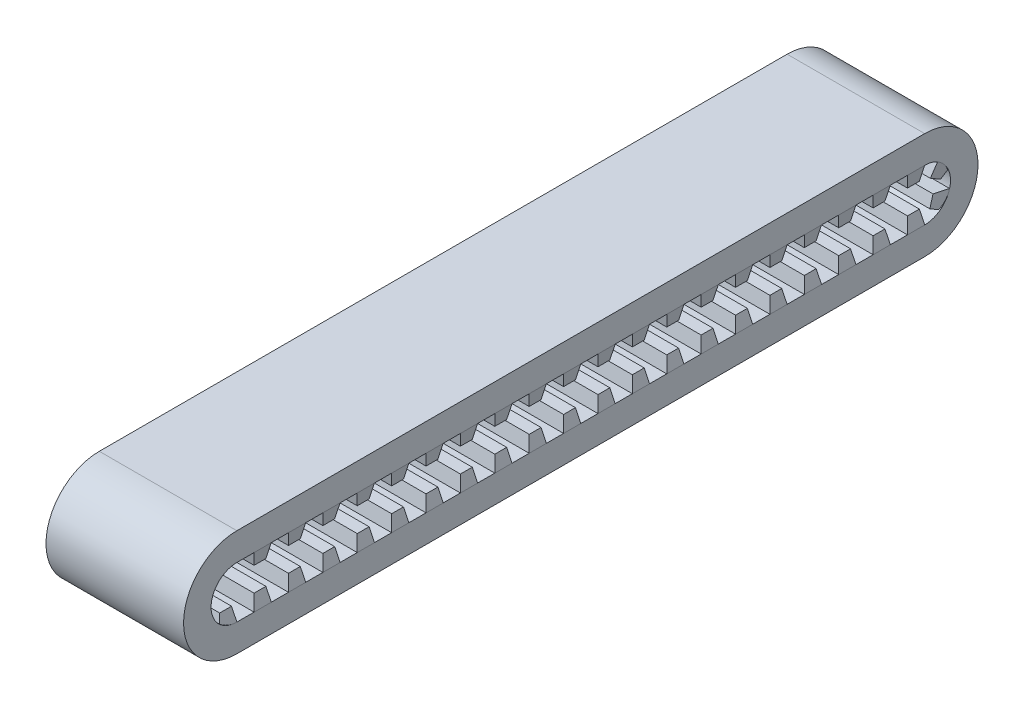
from build123d import *

# Parameters (mm, degrees)
BOSS_EXTRUDE1_DEPTH      = 40
SKETCH2_W                = 40
SKETCH2_H                = 5
BOSS_EXTRUDE2_DEPTH      = 4
BOSS_EXTRUDE2_TAPER      = 11
LPATTERN1_COUNT          = 19
LPATTERN1_PITCH          = 10
CIRPATTERN1_COUNT        = 3
CIRPATTERN1_ANGLE        = 150
MIRROR1_COPY_1_SKETCH_W  = 40
MIRROR1_COPY_1_SKETCH_H  = 5
MIRROR1_COPY_1_DEPTH     = 4
MIRROR1_COPY_1_TAPER     = 11
MIRROR1_COPY_2_SKETCH_W  = 40
MIRROR1_COPY_2_SKETCH_H  = 5
MIRROR1_COPY_2_DEPTH     = 4
MIRROR1_COPY_2_TAPER     = 11
MIRROR1_COPY_3_SKETCH_W  = 40
MIRROR1_COPY_3_SKETCH_H  = 5
MIRROR1_COPY_3_DEPTH     = 4
MIRROR1_COPY_3_TAPER     = 11
MIRROR1_COPY_4_SKETCH_W  = 40
MIRROR1_COPY_4_SKETCH_H  = 5
MIRROR1_COPY_4_DEPTH     = 4
MIRROR1_COPY_4_TAPER     = 11
MIRROR1_COPY_5_SKETCH_W  = 40
MIRROR1_COPY_5_SKETCH_H  = 5
MIRROR1_COPY_5_DEPTH     = 4
MIRROR1_COPY_5_TAPER     = 11
MIRROR1_COPY_6_SKETCH_W  = 40
MIRROR1_COPY_6_SKETCH_H  = 5
MIRROR1_COPY_6_DEPTH     = 4
MIRROR1_COPY_6_TAPER     = 11
MIRROR1_COPY_7_SKETCH_W  = 40
MIRROR1_COPY_7_SKETCH_H  = 5
MIRROR1_COPY_7_DEPTH     = 4
MIRROR1_COPY_7_TAPER     = 11
MIRROR1_COPY_8_SKETCH_W  = 40
MIRROR1_COPY_8_SKETCH_H  = 5
MIRROR1_COPY_8_DEPTH     = 4
MIRROR1_COPY_8_TAPER     = 11
MIRROR1_COPY_9_SKETCH_W  = 40
MIRROR1_COPY_9_SKETCH_H  = 5
MIRROR1_COPY_9_DEPTH     = 4
MIRROR1_COPY_9_TAPER     = 11
MIRROR1_COPY_10_SKETCH_W = 40
MIRROR1_COPY_10_SKETCH_H = 5
MIRROR1_COPY_10_DEPTH    = 4
MIRROR1_COPY_10_TAPER    = 11
MIRROR1_COPY_11_SKETCH_W = 40
MIRROR1_COPY_11_SKETCH_H = 5
MIRROR1_COPY_11_DEPTH    = 4
MIRROR1_COPY_11_TAPER    = 11
MIRROR1_COPY_12_SKETCH_W = 40
MIRROR1_COPY_12_SKETCH_H = 5
MIRROR1_COPY_12_DEPTH    = 4
MIRROR1_COPY_12_TAPER    = 11
MIRROR1_COPY_13_SKETCH_W = 40
MIRROR1_COPY_13_SKETCH_H = 5
MIRROR1_COPY_13_DEPTH    = 4
MIRROR1_COPY_13_TAPER    = 11
MIRROR1_COPY_14_SKETCH_W = 40
MIRROR1_COPY_14_SKETCH_H = 5
MIRROR1_COPY_14_DEPTH    = 4
MIRROR1_COPY_14_TAPER    = 11
MIRROR1_COPY_15_SKETCH_W = 40
MIRROR1_COPY_15_SKETCH_H = 5
MIRROR1_COPY_15_DEPTH    = 4
MIRROR1_COPY_15_TAPER    = 11
MIRROR1_COPY_16_SKETCH_W = 40
MIRROR1_COPY_16_SKETCH_H = 5
MIRROR1_COPY_16_DEPTH    = 4
MIRROR1_COPY_16_TAPER    = 11
MIRROR1_COPY_17_SKETCH_W = 40
MIRROR1_COPY_17_SKETCH_H = 5
MIRROR1_COPY_17_DEPTH    = 4
MIRROR1_COPY_17_TAPER    = 11
MIRROR1_COPY_18_SKETCH_W = 40
MIRROR1_COPY_18_SKETCH_H = 5
MIRROR1_COPY_18_DEPTH    = 4
MIRROR1_COPY_18_TAPER    = 11
SKETCH3_W                = 40
SKETCH3_H                = 5
BOSS_EXTRUDE3_DEPTH      = 4
BOSS_EXTRUDE3_TAPER      = 11
LPATTERN2_COUNT          = 2
LPATTERN2_PITCH          = 10


with BuildPart() as part:
    # Sketch1 → Boss-Extrude1 (new body)
    with BuildSketch(Plane(origin=(0, 0, 0), x_dir=(0, 0, -1), z_dir=(1, 0, 0))):
        with BuildLine():
            Line((-100, 15.5), (100, 15.5))
            ThreePointArc((100, 15.5), (115.5, 0), (100, -15.5))
            Line((100, -15.5), (-100, -15.5))
            ThreePointArc((-100, -15.5), (-115.5, 0), (-100, 15.5))
        make_face()
        with BuildLine():
            Line((-100, 7.5), (100, 7.5))
            ThreePointArc((100, 7.5), (107.5, 0), (100, -7.5))
            Line((100, -7.5), (-100, -7.5))
            ThreePointArc((-100, -7.5), (-107.5, 0), (-100, 7.5))
        make_face(mode=Mode.SUBTRACT)
    extrude(amount=BOSS_EXTRUDE1_DEPTH)

    # Sketch2 → Boss-Extrude2 (add)
    with BuildSketch(Plane(origin=(0, -7.5, 0), x_dir=(1, 0, 0), z_dir=(0, 1, 0))):
        with Locations((20, 97.5)):
            Rectangle(SKETCH2_W, SKETCH2_H)
    boss_extrude2 = extrude(amount=BOSS_EXTRUDE2_DEPTH, taper=BOSS_EXTRUDE2_TAPER)

    # LPattern1: Boss-Extrude2 ×19
    with Locations(*[(0, 0, i * LPATTERN1_PITCH) for i in range(1, LPATTERN1_COUNT)]):
        add(boss_extrude2)

    # CirPattern1: Boss-Extrude2 ×3 about axis
    cirpattern1_axis = Axis((0, 0, -100), (1, 0, 0))
    for i in range(1, CIRPATTERN1_COUNT):
        add(boss_extrude2.rotate(cirpattern1_axis, i * CIRPATTERN1_ANGLE / (CIRPATTERN1_COUNT - 1)))

    # Mirror1: Boss-Extrude2 across plane
    add(boss_extrude2.mirror(Plane.ZX))

    # Mirror1 copy 1 sketch → Mirror1 copy 1 (add)
    with BuildSketch(Plane(origin=(0, 7.5, 10), x_dir=(1, 0, 0), z_dir=(0, -1, 0))):
        with Locations((20, -97.5)):
            Rectangle(MIRROR1_COPY_1_SKETCH_W, MIRROR1_COPY_1_SKETCH_H)
    extrude(amount=MIRROR1_COPY_1_DEPTH, taper=MIRROR1_COPY_1_TAPER)

    # Mirror1 copy 2 sketch → Mirror1 copy 2 (add)
    with BuildSketch(Plane(origin=(0, 7.5, 20), x_dir=(1, 0, 0), z_dir=(0, -1, 0))):
        with Locations((20, -97.5)):
            Rectangle(MIRROR1_COPY_2_SKETCH_W, MIRROR1_COPY_2_SKETCH_H)
    extrude(amount=MIRROR1_COPY_2_DEPTH, taper=MIRROR1_COPY_2_TAPER)

    # Mirror1 copy 3 sketch → Mirror1 copy 3 (add)
    with BuildSketch(Plane(origin=(0, 7.5, 30), x_dir=(1, 0, 0), z_dir=(0, -1, 0))):
        with Locations((20, -97.5)):
            Rectangle(MIRROR1_COPY_3_SKETCH_W, MIRROR1_COPY_3_SKETCH_H)
    extrude(amount=MIRROR1_COPY_3_DEPTH, taper=MIRROR1_COPY_3_TAPER)

    # Mirror1 copy 4 sketch → Mirror1 copy 4 (add)
    with BuildSketch(Plane(origin=(0, 7.5, 40), x_dir=(1, 0, 0), z_dir=(0, -1, 0))):
        with Locations((20, -97.5)):
            Rectangle(MIRROR1_COPY_4_SKETCH_W, MIRROR1_COPY_4_SKETCH_H)
    extrude(amount=MIRROR1_COPY_4_DEPTH, taper=MIRROR1_COPY_4_TAPER)

    # Mirror1 copy 5 sketch → Mirror1 copy 5 (add)
    with BuildSketch(Plane(origin=(0, 7.5, 50), x_dir=(1, 0, 0), z_dir=(0, -1, 0))):
        with Locations((20, -97.5)):
            Rectangle(MIRROR1_COPY_5_SKETCH_W, MIRROR1_COPY_5_SKETCH_H)
    extrude(amount=MIRROR1_COPY_5_DEPTH, taper=MIRROR1_COPY_5_TAPER)

    # Mirror1 copy 6 sketch → Mirror1 copy 6 (add)
    with BuildSketch(Plane(origin=(0, 7.5, 60), x_dir=(1, 0, 0), z_dir=(0, -1, 0))):
        with Locations((20, -97.5)):
            Rectangle(MIRROR1_COPY_6_SKETCH_W, MIRROR1_COPY_6_SKETCH_H)
    extrude(amount=MIRROR1_COPY_6_DEPTH, taper=MIRROR1_COPY_6_TAPER)

    # Mirror1 copy 7 sketch → Mirror1 copy 7 (add)
    with BuildSketch(Plane(origin=(0, 7.5, 70), x_dir=(1, 0, 0), z_dir=(0, -1, 0))):
        with Locations((20, -97.5)):
            Rectangle(MIRROR1_COPY_7_SKETCH_W, MIRROR1_COPY_7_SKETCH_H)
    extrude(amount=MIRROR1_COPY_7_DEPTH, taper=MIRROR1_COPY_7_TAPER)

    # Mirror1 copy 8 sketch → Mirror1 copy 8 (add)
    with BuildSketch(Plane(origin=(0, 7.5, 80), x_dir=(1, 0, 0), z_dir=(0, -1, 0))):
        with Locations((20, -97.5)):
            Rectangle(MIRROR1_COPY_8_SKETCH_W, MIRROR1_COPY_8_SKETCH_H)
    extrude(amount=MIRROR1_COPY_8_DEPTH, taper=MIRROR1_COPY_8_TAPER)

    # Mirror1 copy 9 sketch → Mirror1 copy 9 (add)
    with BuildSketch(Plane(origin=(0, 7.5, 90), x_dir=(1, 0, 0), z_dir=(0, -1, 0))):
        with Locations((20, -97.5)):
            Rectangle(MIRROR1_COPY_9_SKETCH_W, MIRROR1_COPY_9_SKETCH_H)
    extrude(amount=MIRROR1_COPY_9_DEPTH, taper=MIRROR1_COPY_9_TAPER)

    # Mirror1 copy 10 sketch → Mirror1 copy 10 (add)
    with BuildSketch(Plane(origin=(0, 7.5, 100), x_dir=(1, 0, 0), z_dir=(0, -1, 0))):
        with Locations((20, -97.5)):
            Rectangle(MIRROR1_COPY_10_SKETCH_W, MIRROR1_COPY_10_SKETCH_H)
    extrude(amount=MIRROR1_COPY_10_DEPTH, taper=MIRROR1_COPY_10_TAPER)

    # Mirror1 copy 11 sketch → Mirror1 copy 11 (add)
    with BuildSketch(Plane(origin=(0, 7.5, 110), x_dir=(1, 0, 0), z_dir=(0, -1, 0))):
        with Locations((20, -97.5)):
            Rectangle(MIRROR1_COPY_11_SKETCH_W, MIRROR1_COPY_11_SKETCH_H)
    extrude(amount=MIRROR1_COPY_11_DEPTH, taper=MIRROR1_COPY_11_TAPER)

    # Mirror1 copy 12 sketch → Mirror1 copy 12 (add)
    with BuildSketch(Plane(origin=(0, 7.5, 120), x_dir=(1, 0, 0), z_dir=(0, -1, 0))):
        with Locations((20, -97.5)):
            Rectangle(MIRROR1_COPY_12_SKETCH_W, MIRROR1_COPY_12_SKETCH_H)
    extrude(amount=MIRROR1_COPY_12_DEPTH, taper=MIRROR1_COPY_12_TAPER)

    # Mirror1 copy 13 sketch → Mirror1 copy 13 (add)
    with BuildSketch(Plane(origin=(0, 7.5, 130), x_dir=(1, 0, 0), z_dir=(0, -1, 0))):
        with Locations((20, -97.5)):
            Rectangle(MIRROR1_COPY_13_SKETCH_W, MIRROR1_COPY_13_SKETCH_H)
    extrude(amount=MIRROR1_COPY_13_DEPTH, taper=MIRROR1_COPY_13_TAPER)

    # Mirror1 copy 14 sketch → Mirror1 copy 14 (add)
    with BuildSketch(Plane(origin=(0, 7.5, 140), x_dir=(1, 0, 0), z_dir=(0, -1, 0))):
        with Locations((20, -97.5)):
            Rectangle(MIRROR1_COPY_14_SKETCH_W, MIRROR1_COPY_14_SKETCH_H)
    extrude(amount=MIRROR1_COPY_14_DEPTH, taper=MIRROR1_COPY_14_TAPER)

    # Mirror1 copy 15 sketch → Mirror1 copy 15 (add)
    with BuildSketch(Plane(origin=(0, 7.5, 150), x_dir=(1, 0, 0), z_dir=(0, -1, 0))):
        with Locations((20, -97.5)):
            Rectangle(MIRROR1_COPY_15_SKETCH_W, MIRROR1_COPY_15_SKETCH_H)
    extrude(amount=MIRROR1_COPY_15_DEPTH, taper=MIRROR1_COPY_15_TAPER)

    # Mirror1 copy 16 sketch → Mirror1 copy 16 (add)
    with BuildSketch(Plane(origin=(0, 7.5, 160), x_dir=(1, 0, 0), z_dir=(0, -1, 0))):
        with Locations((20, -97.5)):
            Rectangle(MIRROR1_COPY_16_SKETCH_W, MIRROR1_COPY_16_SKETCH_H)
    extrude(amount=MIRROR1_COPY_16_DEPTH, taper=MIRROR1_COPY_16_TAPER)

    # Mirror1 copy 17 sketch → Mirror1 copy 17 (add)
    with BuildSketch(Plane(origin=(0, 7.5, 170), x_dir=(1, 0, 0), z_dir=(0, -1, 0))):
        with Locations((20, -97.5)):
            Rectangle(MIRROR1_COPY_17_SKETCH_W, MIRROR1_COPY_17_SKETCH_H)
    extrude(amount=MIRROR1_COPY_17_DEPTH, taper=MIRROR1_COPY_17_TAPER)

    # Mirror1 copy 18 sketch → Mirror1 copy 18 (add)
    with BuildSketch(Plane(origin=(0, 7.5, 180), x_dir=(1, 0, 0), z_dir=(0, -1, 0))):
        with Locations((20, -97.5)):
            Rectangle(MIRROR1_COPY_18_SKETCH_W, MIRROR1_COPY_18_SKETCH_H)
    extrude(amount=MIRROR1_COPY_18_DEPTH, taper=MIRROR1_COPY_18_TAPER)

    # Sketch3 → Boss-Extrude3 (add)
    with BuildSketch(Plane(origin=(0, -7.5, 0), x_dir=(1, 0, 0), z_dir=(0, 1, 0))):
        with Locations((20, -92.5)):
            Rectangle(SKETCH3_W, SKETCH3_H)
    boss_extrude3 = extrude(amount=BOSS_EXTRUDE3_DEPTH, taper=BOSS_EXTRUDE3_TAPER)

    # LPattern2: Boss-Extrude3 ×2
    with Locations(*[(0, 0, i * LPATTERN2_PITCH) for i in range(1, LPATTERN2_COUNT)]):
        add(boss_extrude3)

    # Mirror2: Boss-Extrude3 across plane
    add(boss_extrude3.mirror(Plane.ZX))


solid = part.part
